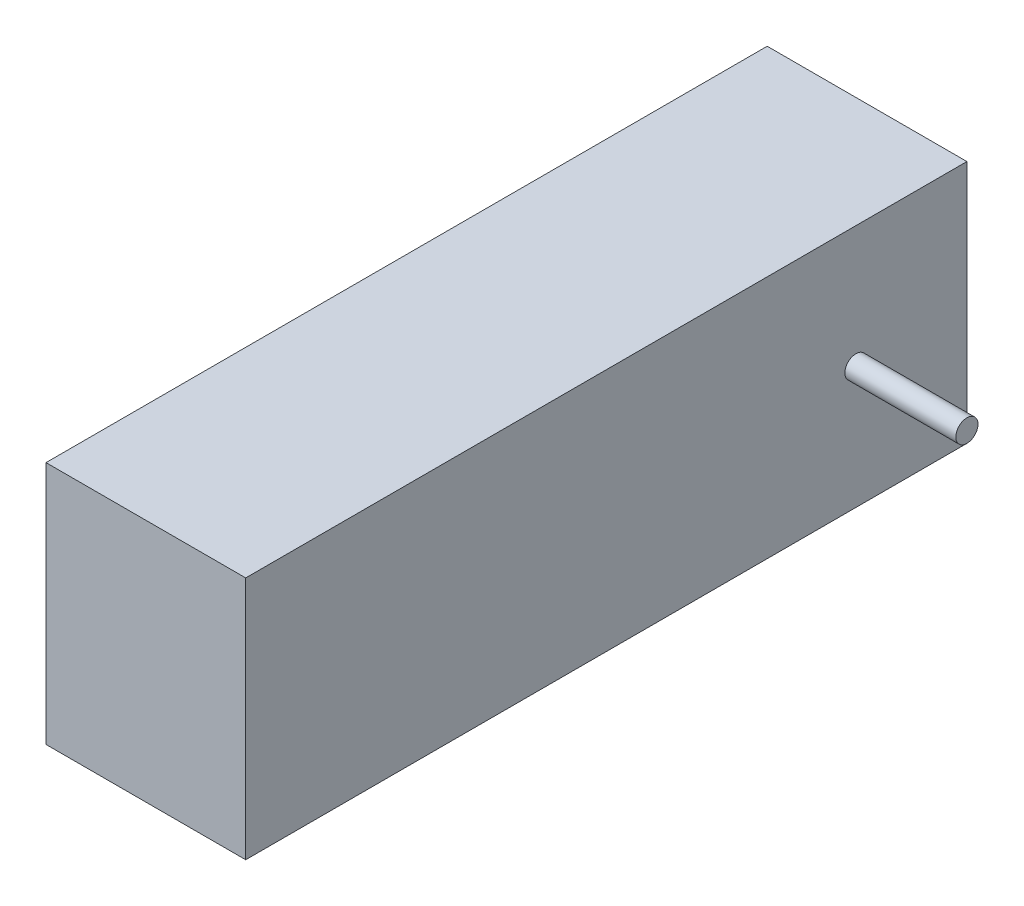
from build123d import *

# Parameters (mm, degrees)
SKETCH_1_W           = 18
SKETCH_1_H           = 22
EXTRUDE_1_DEPTH      = 65
EXTRUDE_2_DEPTH      = 10
EXTRUDE_2_DEPTH_BACK = 28
SKETCH_2_R           = 1


with BuildPart() as part:
    # 草圖1 → 填料-伸長1 (new body)
    with BuildSketch(Plane.XY):
        Rectangle(SKETCH_1_W, SKETCH_1_H)
    extrude(amount=EXTRUDE_1_DEPTH)

    # 草圖2 → 填料-伸長2 (add, two sides: drawn at the far end of the back side and taken through both)
    with BuildSketch(Plane(origin=(9, 0, 0), x_dir=(0, 0, -1), z_dir=(1, 0, 0)).offset(-EXTRUDE_2_DEPTH_BACK)):
        with Locations(Location((-10, 0, 0), (0, 0, 90))):
            Circle(SKETCH_2_R)
    extrude(amount=EXTRUDE_2_DEPTH + EXTRUDE_2_DEPTH_BACK)


solid = part.part
